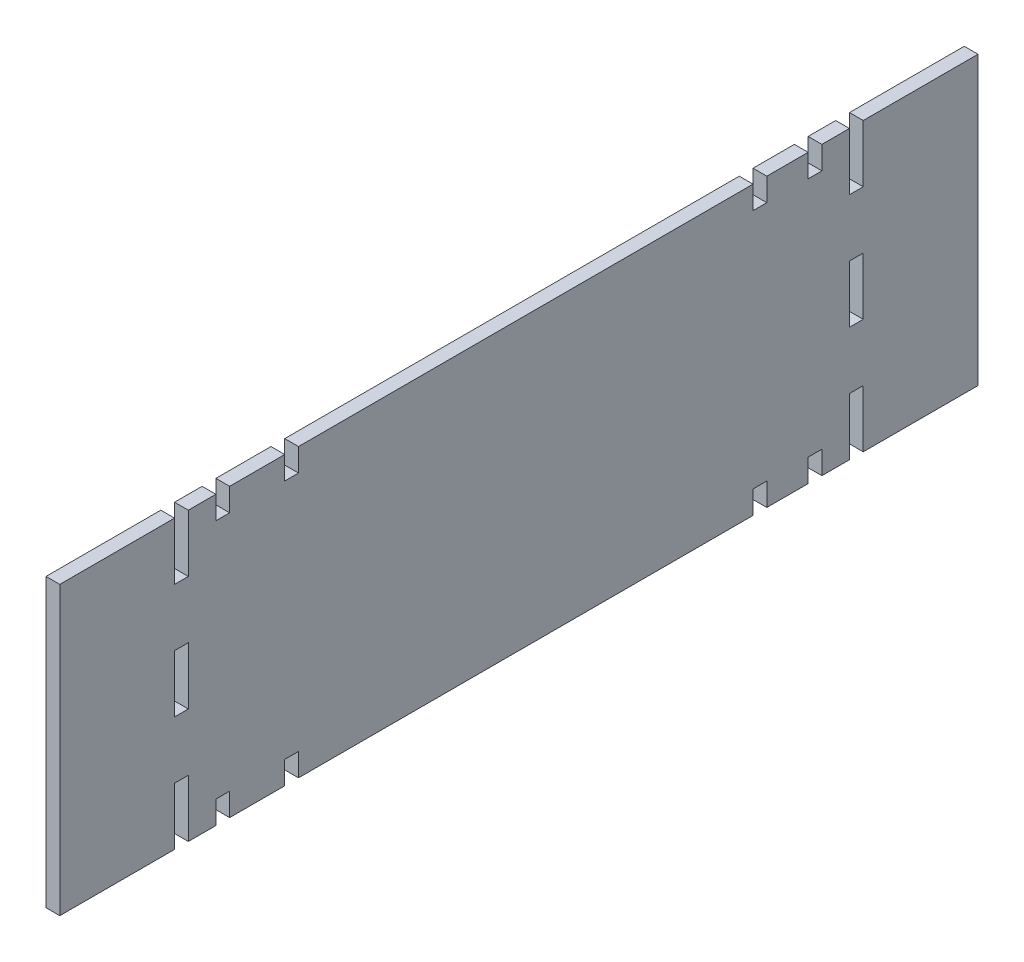
from build123d import *

# Parameters (mm, degrees)
SKETCH1_W            = 400
SKETCH1_H            = 125
BOSS_EXTRUDE1_DEPTH  = 6
SKETCH3_W            = 6
SKETCH3_H            = 25
CUT_EXTRUDE1_DEPTH   = 420.119314754
LPATTERN1_COUNT      = 2
LPATTERN1_PITCH      = 294
LPATTERN1_COUNT_DIR2 = 3
LPATTERN1_PITCH_DIR2 = 50
SKETCH4_W            = 6
SKETCH4_H            = 10
CUT_EXTRUDE2_DEPTH   = 420.119314754
LPATTERN2_COUNT      = 2
LPATTERN2_PITCH      = 258
LPATTERN2_COUNT_DIR2 = 2
LPATTERN2_PITCH_DIR2 = 115
SKETCH5_W            = 6
SKETCH5_H            = 10
CUT_EXTRUDE3_DEPTH   = 420.119314754
LPATTERN3_COUNT      = 2
LPATTERN3_PITCH      = 115
LPATTERN3_COUNT_DIR2 = 2
LPATTERN3_PITCH_DIR2 = 204


with BuildPart() as part:
    # Sketch1 → Boss-Extrude1 (new body)
    with BuildSketch(Plane(origin=(0, 0, 0), x_dir=(0, 0, -1), z_dir=(1, 0, 0))):
        with Locations((-200, 62.5)):
            Rectangle(SKETCH1_W, SKETCH1_H)
    extrude(amount=BOSS_EXTRUDE1_DEPTH)

    # Sketch3 → Cut-Extrude1 (cut, through all)
    with BuildSketch(Plane(origin=(6, 0, 0), x_dir=(0, 0, -1), z_dir=(1, 0, 0))):
        with Locations((-347, 112.5)):
            Rectangle(SKETCH3_W, SKETCH3_H)
    cut_extrude1 = extrude(amount=-CUT_EXTRUDE1_DEPTH, mode=Mode.SUBTRACT)

    # LPattern1: Cut-Extrude1 2 × 3
    with Locations(*[(0, -j * LPATTERN1_PITCH_DIR2, -i * LPATTERN1_PITCH) for i in range(LPATTERN1_COUNT) for j in range(LPATTERN1_COUNT_DIR2) if (i, j) != (0, 0)]):
        add(cut_extrude1, mode=Mode.SUBTRACT)

    # Sketch4 → Cut-Extrude2 (cut, through all)
    with BuildSketch(Plane(origin=(6, 0, 0), x_dir=(0, 0, -1), z_dir=(1, 0, 0))):
        with Locations((-329, 120)):
            Rectangle(SKETCH4_W, SKETCH4_H)
    cut_extrude2 = extrude(amount=-CUT_EXTRUDE2_DEPTH, mode=Mode.SUBTRACT)

    # LPattern2: Cut-Extrude2 2 × 2
    with Locations(*[(0, -j * LPATTERN2_PITCH_DIR2, -i * LPATTERN2_PITCH) for i in range(LPATTERN2_COUNT) for j in range(LPATTERN2_COUNT_DIR2) if (i, j) != (0, 0)]):
        add(cut_extrude2, mode=Mode.SUBTRACT)

    # Sketch5 → Cut-Extrude3 (cut, through all)
    with BuildSketch(Plane(origin=(6, 0, 0), x_dir=(0, 0, -1), z_dir=(1, 0, 0))):
        with Locations((-299, 120)):
            Rectangle(SKETCH5_W, SKETCH5_H)
    cut_extrude3 = extrude(amount=-CUT_EXTRUDE3_DEPTH, mode=Mode.SUBTRACT)

    # LPattern3: Cut-Extrude3 2 × 2
    with Locations(*[(0, -i * LPATTERN3_PITCH, -j * LPATTERN3_PITCH_DIR2) for i in range(LPATTERN3_COUNT) for j in range(LPATTERN3_COUNT_DIR2) if (i, j) != (0, 0)]):
        add(cut_extrude3, mode=Mode.SUBTRACT)


solid = part.part
